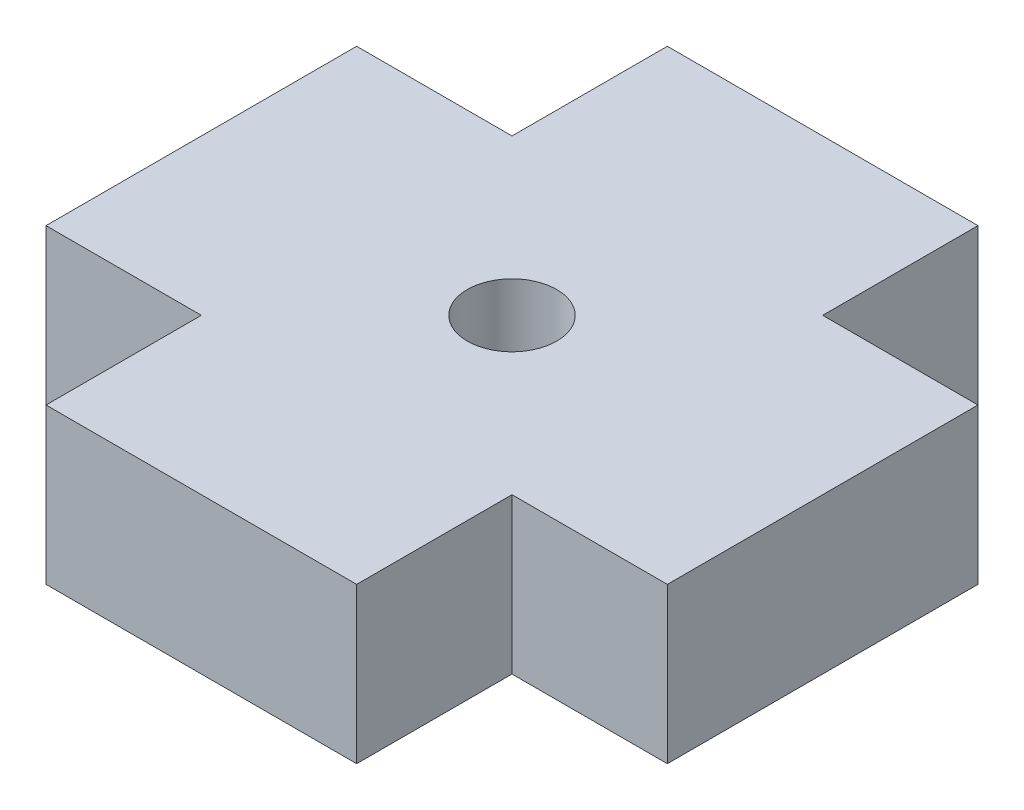
from build123d import *

# Parameters (mm, degrees)
SKETCH1_W           = 12.7
SKETCH1_H           = 25.4
SKETCH1_R           = 1.8288
SKETCH1_W_2         = 6.35
SKETCH1_H_2         = 12.7
BOSS_EXTRUDE1_DEPTH = 6.35


with BuildPart() as part:
    # Sketch1 → Boss-Extrude1 (new body)
    # profile 1 of 3: a face of its own
    with BuildSketch(Plane(origin=(0, 0, 0), x_dir=(1, 0, 0), z_dir=(0, 1, 0))):
        with Locations((6.35, -12.7)):
            Rectangle(SKETCH1_W, SKETCH1_H)
        with Locations(Location((6.35, -12.7, 0), (0, 0, 270))):
            Circle(SKETCH1_R, mode=Mode.SUBTRACT)
    # profile 2 of 3: a face of its own
    with BuildSketch(Plane(origin=(0, 0, 0), x_dir=(1, 0, 0), z_dir=(0, 1, 0))):
        with Locations((15.875, -12.7)):
            Rectangle(SKETCH1_W_2, SKETCH1_H_2)
    # profile 3 of 3: a face of its own
    with BuildSketch(Plane(origin=(0, 0, 0), x_dir=(1, 0, 0), z_dir=(0, 1, 0))):
        with Locations((-3.175, -12.7)):
            Rectangle(SKETCH1_W_2, SKETCH1_H_2)
    extrude(amount=BOSS_EXTRUDE1_DEPTH)


solid = part.part
